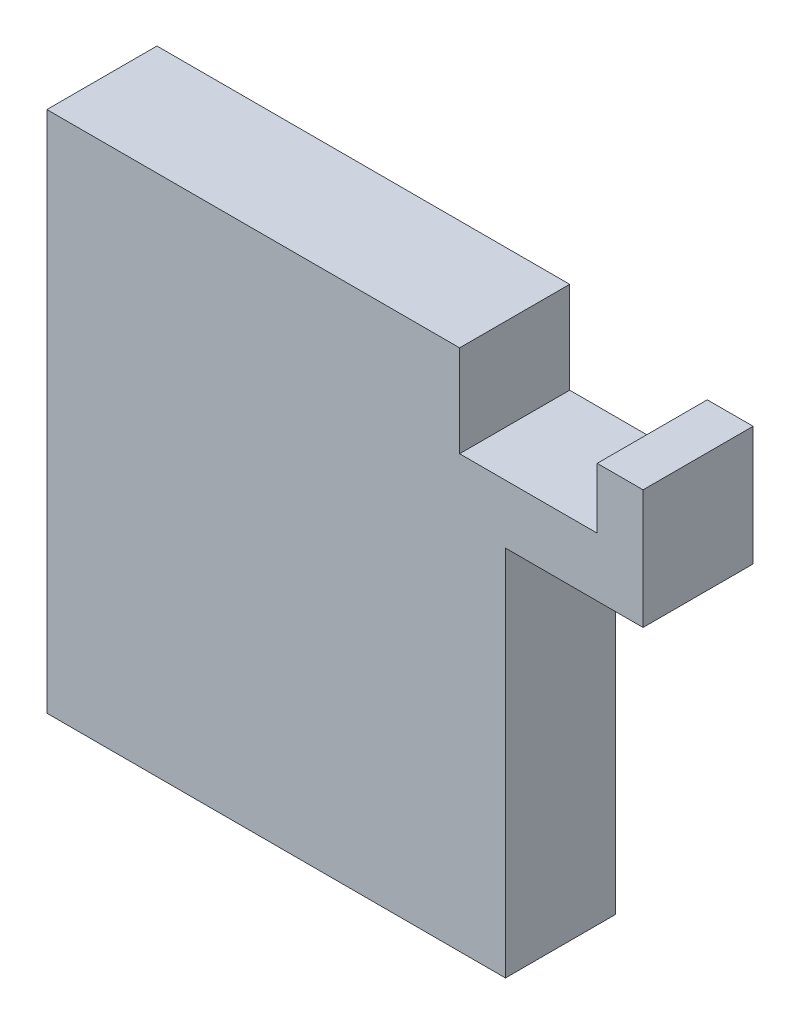
from build123d import *

# Parameters (mm, degrees)
EXTRUDE_1_DEPTH = 1.2


with BuildPart() as part:
    # 草图1 → 凸台-拉伸1 (new body)
    with BuildSketch(Plane.XY):
        Polygon((3.4, 10.5), (3.4, 4.8), (8.4, 4.8), (8.4, 8.859461555), (9.9, 8.859461555), (9.9, 10.159461555), (9.4, 10.159461555), (9.4, 9.5), (7.9, 9.5), (7.9, 10.5), align=None)
    extrude(amount=EXTRUDE_1_DEPTH)


solid = part.part
